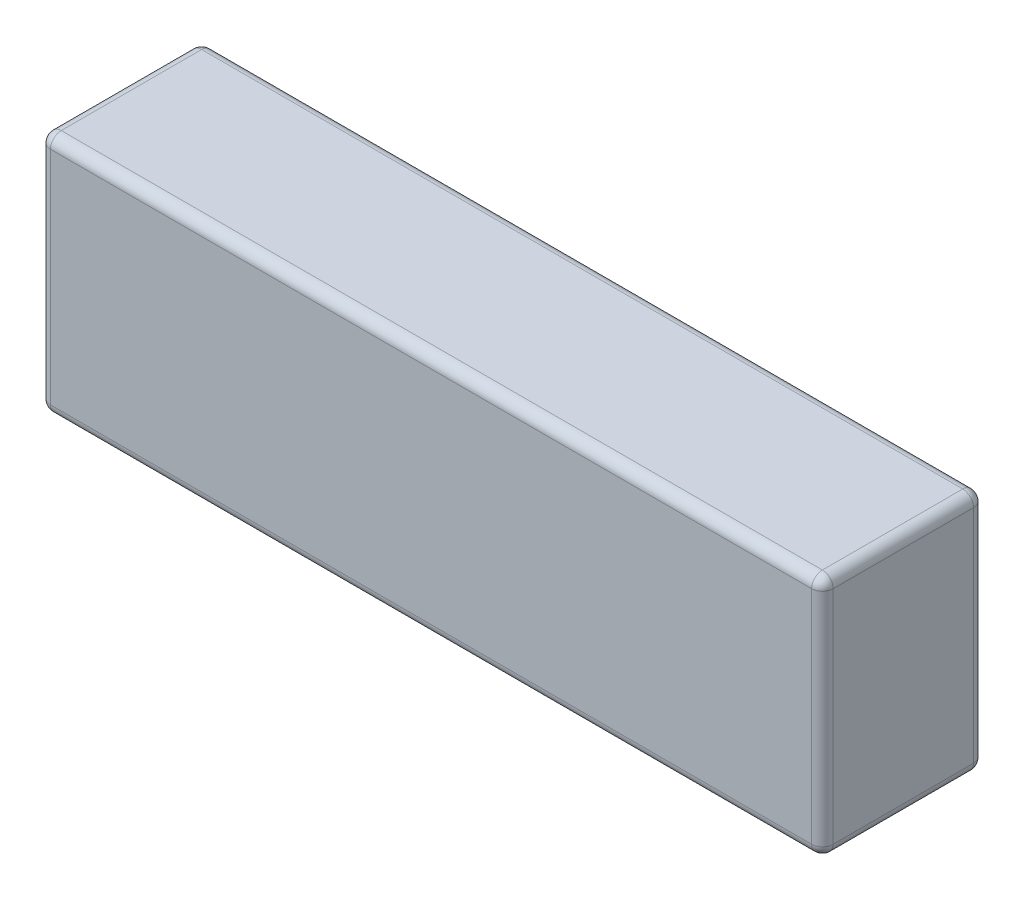
from build123d import *

# Parameters (mm, degrees)
ESQUISSE1_W        = 145
ESQUISSE1_H        = 45
BOSS_EXTRU_1_DEPTH = 30
CONG_1_R           = 2


with BuildPart() as part:
    # Esquisse1 → Boss.-Extru.1 (new body)
    with BuildSketch(Plane.XY):
        with Locations((72.5, 22.5)):
            Rectangle(ESQUISSE1_W, ESQUISSE1_H)
    extrude(amount=BOSS_EXTRU_1_DEPTH)

    # Congé1
    cong_1_edges = [part.edges().sort_by_distance(p)[0] for p in [
        (145, 22.5, 30),
        (72.5, 45, 30),
        (0, 22.5, 30),
        (72.5, 45, 0),
        (145, 22.5, 0),
        (72.5, 0, 0),
        (0, 22.5, 0),
        (72.5, 0, 30),
        (0, 45, 15),
        (145, 45, 15),
        (145, 0, 15),
        (0, 0, 15),
    ]]
    fillet(cong_1_edges, radius=CONG_1_R)


solid = part.part
